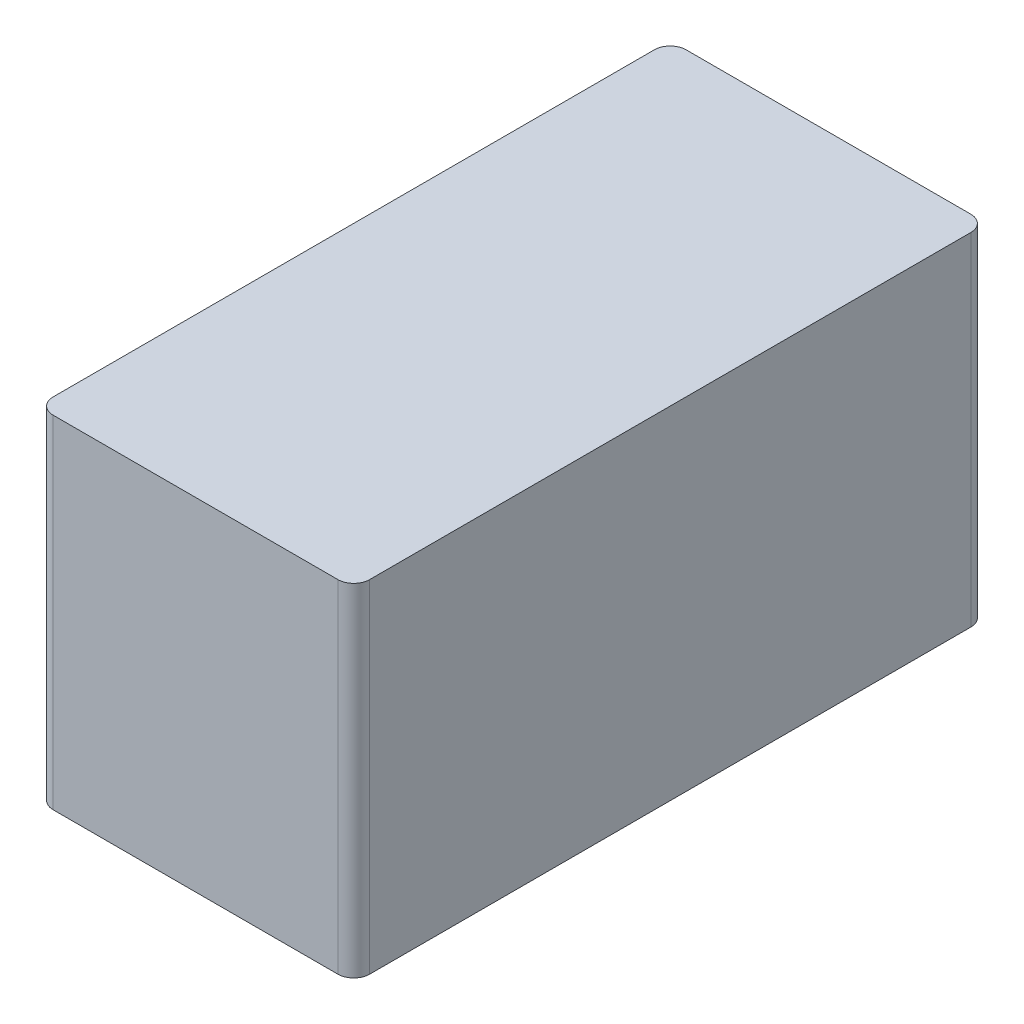
from build123d import *

# Parameters (mm, degrees)
SKETCH1_W           = 20
SKETCH1_H           = 40
BOSS_EXTRUDE1_DEPTH = 10.8
FILLET1_R           = 1


with BuildPart() as part:
    # Sketch1 → Boss-Extrude1 (new, symmetric)
    with BuildSketch(Plane(origin=(0, 0, 0), x_dir=(1, 0, 0), z_dir=(0, 1, 0))):
        Rectangle(SKETCH1_W, SKETCH1_H)
    extrude(amount=BOSS_EXTRUDE1_DEPTH, both=True)

    # Fillet1
    fillet1_edges = [part.edges().sort_by_distance(p)[0] for p in [
        (10, 0, 20),
        (-10, 0, 20),
        (-10, 0, -20),
        (10, 0, -20),
    ]]
    fillet(fillet1_edges, radius=FILLET1_R)


solid = part.part
